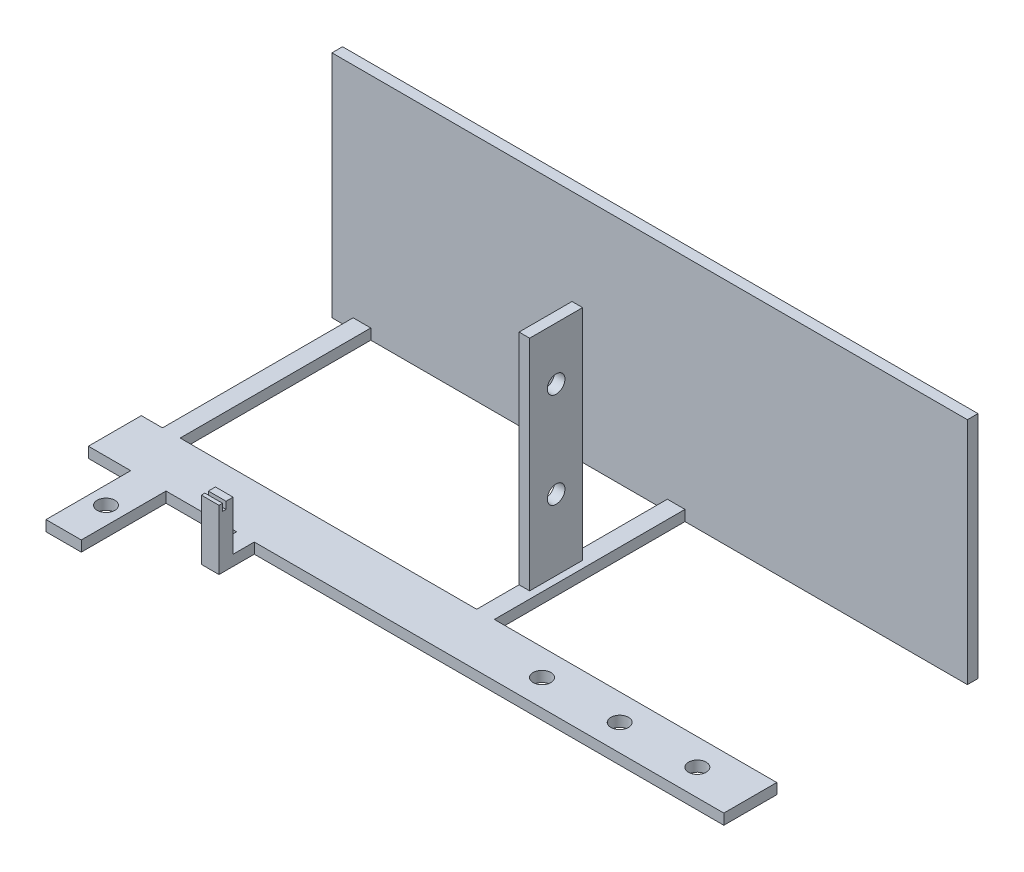
from build123d import *

# Parameters (mm, degrees)
SKETCH1_W           = 1800
SKETCH1_H           = 650
BOSS_EXTRUDE1_DEPTH = 30
SKETCH2_W           = 50
SKETCH2_H           = 30
BOSS_EXTRUDE2_DEPTH = 540
SKETCH3_W           = 1800
SKETCH3_H           = 30
BOSS_EXTRUDE4_DEPTH = 150
SKETCH4_W           = 30
SKETCH4_H           = 150
BOSS_EXTRUDE5_DEPTH = 620
SKETCH5_W           = 100
SKETCH5_H           = 30
BOSS_EXTRUDE6_DEPTH = 240
SKETCH6_W           = 50
SKETCH6_H           = 30
BOSS_EXTRUDE7_DEPTH = 100
SKETCH7_W           = 50
SKETCH7_H           = 40
BOSS_EXTRUDE8_DEPTH = 140
SKETCH8_W           = 50
SKETCH8_H           = 10
CUT_EXTRUDE1_DEPTH  = 20
SKETCH9_R           = 25
CUT_EXTRUDE2_DEPTH  = 40
SKETCH10_R          = 25
CUT_EXTRUDE3_DEPTH  = 40
SKETCH11_R          = 25
CUT_EXTRUDE4_DEPTH  = 40


with BuildPart() as part:
    # Sketch1 → Boss-Extrude1 (new body)
    with BuildSketch(Plane.XY):
        Rectangle(SKETCH1_W, SKETCH1_H)
    extrude(amount=-BOSS_EXTRUDE1_DEPTH)

    # Sketch2 → Boss-Extrude2 (add)
    with BuildSketch(Plane.XY):
        with Locations((75, -310)):
            Rectangle(SKETCH2_W, SKETCH2_H)
        with Locations((-815, -310)):
            Rectangle(SKETCH2_W, SKETCH2_H)
    extrude(amount=BOSS_EXTRUDE2_DEPTH)

    # Sketch3 → Boss-Extrude4 (add)
    with BuildSketch(Plane.XY.offset(540)):
        with Locations((0, -310)):
            Rectangle(SKETCH3_W, SKETCH3_H)
    extrude(amount=BOSS_EXTRUDE4_DEPTH)

    # Sketch4 → Boss-Extrude5 (add)
    with BuildSketch(Plane(origin=(0, -295, 0), x_dir=(1, 0, 0), z_dir=(0, 1, 0))):
        with Locations((65, -345)):
            Rectangle(SKETCH4_W, SKETCH4_H)
    extrude(amount=BOSS_EXTRUDE5_DEPTH)

    # Sketch5 → Boss-Extrude6 (add)
    with BuildSketch(Plane.XY.offset(690)):
        with Locations((-730, -310)):
            Rectangle(SKETCH5_W, SKETCH5_H)
    extrude(amount=BOSS_EXTRUDE6_DEPTH)

    # Sketch6 → Boss-Extrude7 (add)
    with BuildSketch(Plane.XY.offset(690)):
        with Locations((-455, -310)):
            Rectangle(SKETCH6_W, SKETCH6_H)
    extrude(amount=BOSS_EXTRUDE7_DEPTH)

    # Sketch7 → Boss-Extrude8 (add)
    with BuildSketch(Plane(origin=(0, -295, 0), x_dir=(1, 0, 0), z_dir=(0, 1, 0))):
        with Locations((-455, -770)):
            Rectangle(SKETCH7_W, SKETCH7_H)
    extrude(amount=BOSS_EXTRUDE8_DEPTH)

    # Sketch8 → Cut-Extrude1 (cut)
    with BuildSketch(Plane(origin=(0, -155, 0), x_dir=(1, 0, 0), z_dir=(0, 1, 0))):
        with Locations((-455, -775)):
            Rectangle(SKETCH8_W, SKETCH8_H)
    extrude(amount=-CUT_EXTRUDE1_DEPTH, mode=Mode.SUBTRACT)

    # Sketch9 → Cut-Extrude2 (cut)
    with BuildSketch(Plane.XZ.offset(325)):
        with Locations(Location((750, 615, 0), (0, 0, 270))):
            Circle(SKETCH9_R)
        with Locations(Location((530, 615, 0), (0, 0, 270))):
            Circle(SKETCH9_R)
        with Locations(Location((310, 615, 0), (0, 0, 270))):
            Circle(SKETCH9_R)
    extrude(amount=-CUT_EXTRUDE2_DEPTH, mode=Mode.SUBTRACT)

    # Sketch10 → Cut-Extrude3 (cut)
    with BuildSketch(Plane.ZY.offset(-50)):
        with Locations((345, -95)):
            Circle(SKETCH10_R)
        with Locations((345, 175)):
            Circle(SKETCH10_R)
    extrude(amount=-CUT_EXTRUDE3_DEPTH, mode=Mode.SUBTRACT)

    # Sketch11 → Cut-Extrude4 (cut)
    with BuildSketch(Plane.XZ.offset(325)):
        with Locations(Location((-730, 810, 0), (0, 0, 270))):
            Circle(SKETCH11_R)
    extrude(amount=-CUT_EXTRUDE4_DEPTH, mode=Mode.SUBTRACT)


solid = part.part
